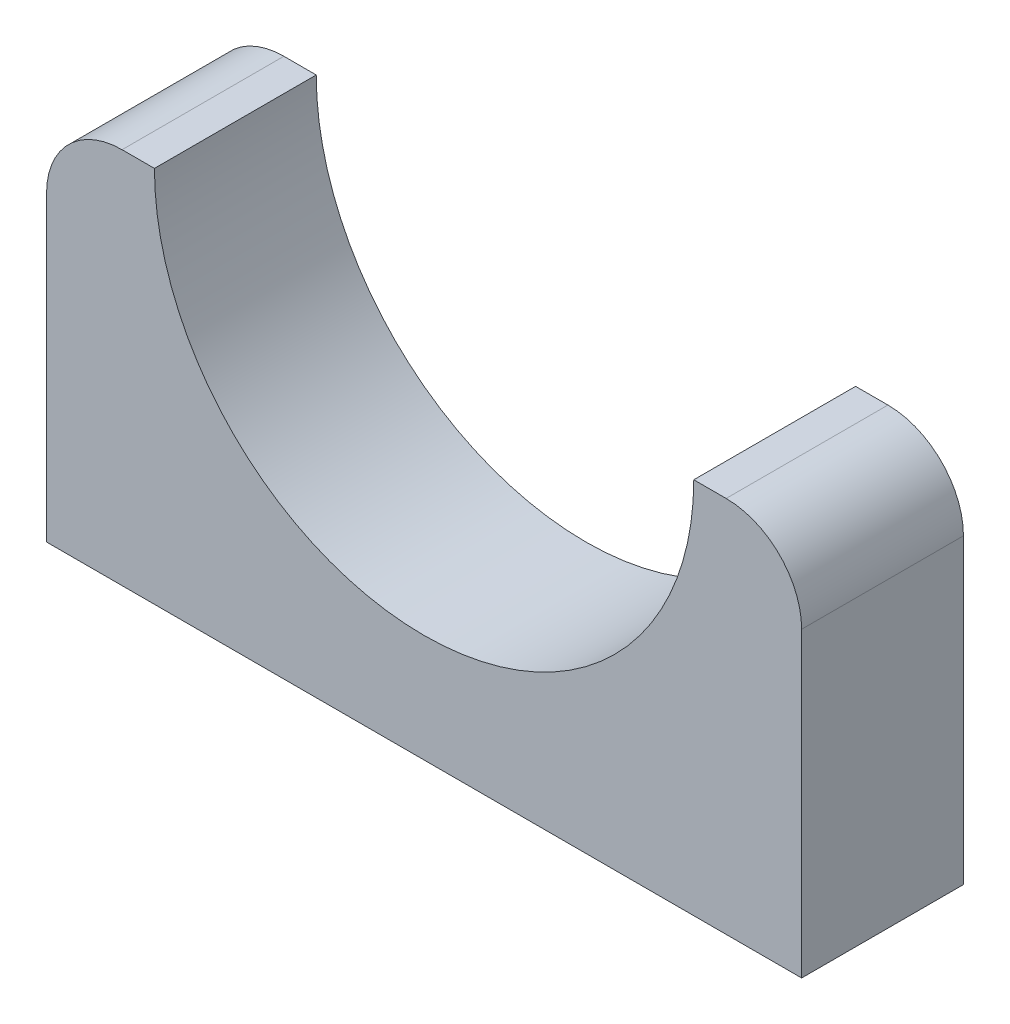
from build123d import *

# Parameters (mm, degrees)
BOSS_EXTRUDE1_DEPTH = 7.5
FILLET1_R           = 3.5


with BuildPart() as part:
    # Sketch1 → Boss-Extrude1 (new body)
    with BuildSketch(Plane.XY):
        with BuildLine():
            Line((-17.5, 0), (17.5, 0))
            Line((17.5, 0), (17.5, 17.5))
            Line((17.5, 17.5), (12.5, 17.5))
            ThreePointArc((12.5, 17.5), (0, 5), (-12.5, 17.5))
            Line((-12.5, 17.5), (-17.5, 17.5))
            Line((-17.5, 17.5), (-17.5, 0))
        make_face()
    extrude(amount=BOSS_EXTRUDE1_DEPTH)

    # Fillet1
    fillet1_edges = [part.edges().sort_by_distance(p)[0] for p in [
        (-17.5, 17.5, 3.75),
        (17.5, 17.5, 3.75),
    ]]
    fillet(fillet1_edges, radius=FILLET1_R)


solid = part.part
